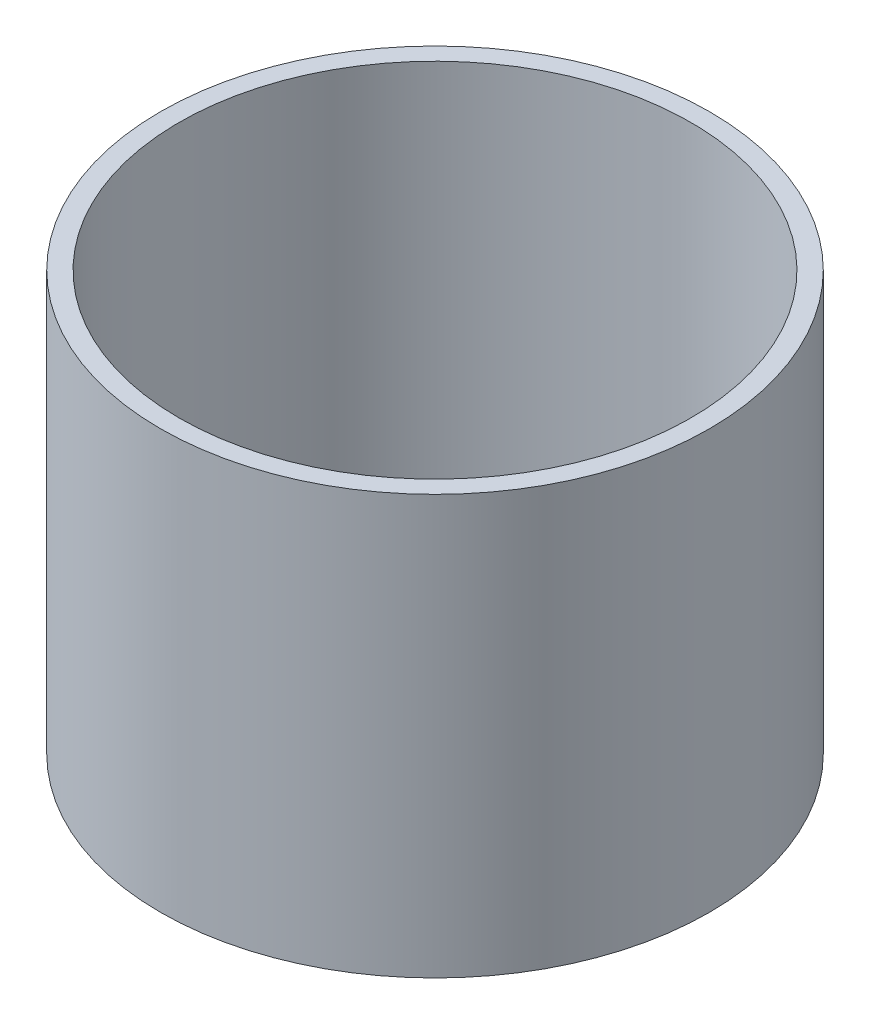
from build123d import *

# Parameters (mm, degrees)
SKETCH1_R           = 118
BOSS_EXTRUDE1_DEPTH = 180
SKETCH3_R           = 110
CUT_EXTRUDE1_DEPTH  = 172
SKETCH6_W           = 19.77
SKETCH6_H           = 45.83
CUT_EXTRUDE2_DEPTH  = 240.649744419
SKETCH7_W           = 16.617647061
SKETCH7_H           = 25
CUT_EXTRUDE3_DEPTH  = 158


with BuildPart() as part:
    # Sketch1 → Boss-Extrude1 (new body)
    with BuildSketch(Plane(origin=(0, 0, 0), x_dir=(1, 0, 0), z_dir=(0, 1, 0))):
        with Locations(Location((0, 0, 0), (0, 0, 90))):
            Circle(SKETCH1_R)
    extrude(amount=BOSS_EXTRUDE1_DEPTH)

    # Sketch3 → Cut-Extrude1 (cut)
    with BuildSketch(Plane(origin=(0, 180, 0), x_dir=(1, 0, 0), z_dir=(0, 1, 0))):
        with Locations(Location((0, 0, 0), (0, 0, 270))):
            Circle(SKETCH3_R)
    extrude(amount=-CUT_EXTRUDE1_DEPTH, mode=Mode.SUBTRACT)

    # Sketch6 → Cut-Extrude2 (cut, through all)
    with BuildSketch(Plane(origin=(0, 8, 0), x_dir=(1, 0, 0), z_dir=(0, 1, 0))):
        Rectangle(SKETCH6_W, SKETCH6_H)
    extrude(amount=-CUT_EXTRUDE2_DEPTH, mode=Mode.SUBTRACT)

    # Sketch7 → Cut-Extrude3 (cut)
    with BuildSketch(Plane.XZ):
        with Locations((0.107153446, 44.591409708)):
            Rectangle(SKETCH7_W, SKETCH7_H)
    extrude(amount=-CUT_EXTRUDE3_DEPTH, mode=Mode.SUBTRACT)


solid = part.part
